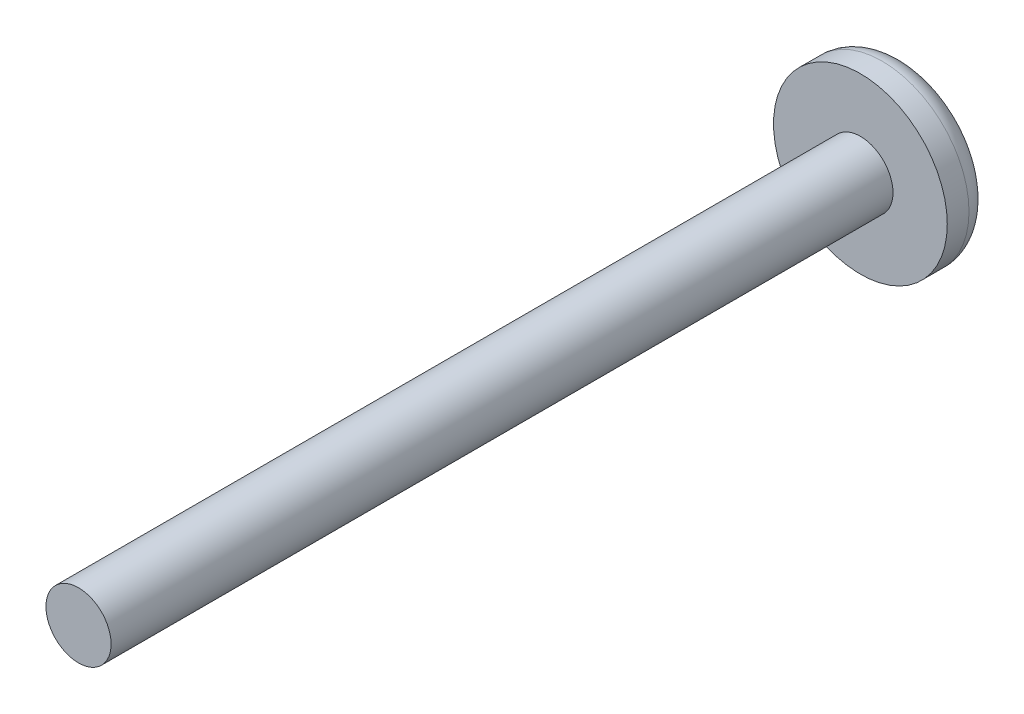
from build123d import *

# Parameters (mm, degrees)
FILLET1_R = 1


with BuildPart() as part:
    # Sketch1 → Revolve1 (revolve)
    with BuildSketch(Plane(origin=(0, 0, 0), x_dir=(1, 0, 0), z_dir=(0, 1, 0))):
        Polygon((0, 0), (0, 38), (4, 38), (4, 36), (1.5, 36), (1.5, 0), align=None)
    revolve(axis=Axis((0, 0, 0), (0, 0, -1)))

    # Fillet1
    fillet1_edges = [part.edges().sort_by_distance(p)[0] for p in [
        (-4, 0, -38),
    ]]
    fillet(fillet1_edges, radius=FILLET1_R)


solid = part.part
